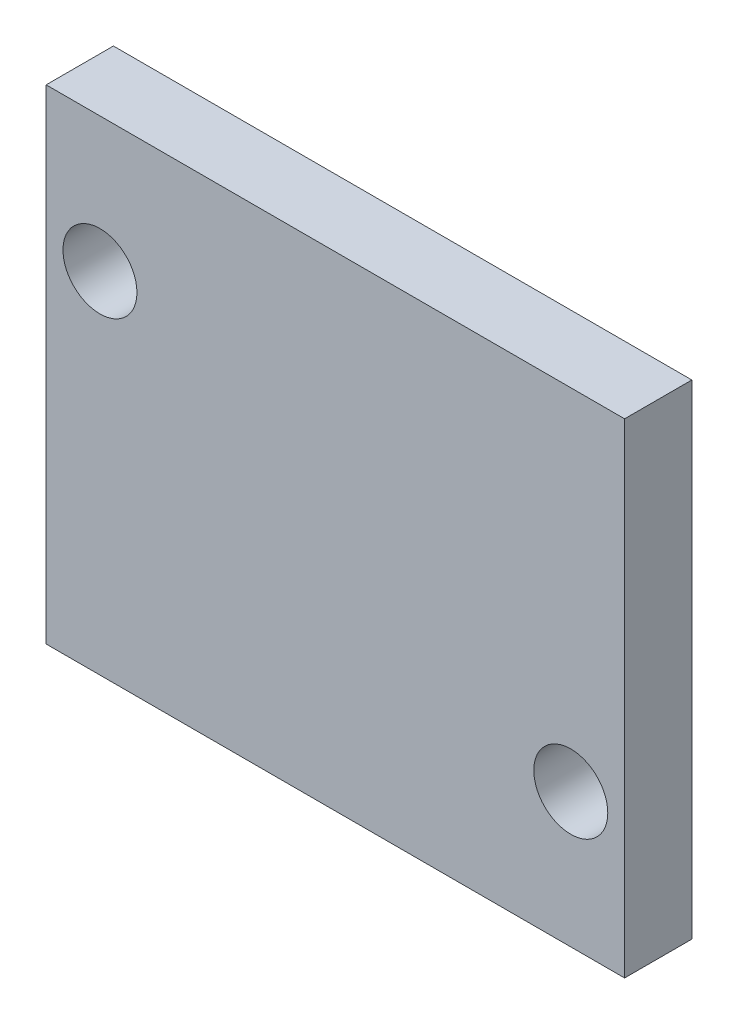
from build123d import *

# Parameters (mm, degrees)
SKIZZE1_W                       = 43
SKIZZE1_H                       = 36
SKIZZE1_R                       = 2.75
AUFSATZ_LINEAR_AUSTRAGEN1_DEPTH = 5


with BuildPart() as part:
    # Skizze1 → Aufsatz-Linear austragen1 (new body)
    with BuildSketch(Plane.XY):
        with Locations((21.5, 18)):
            Rectangle(SKIZZE1_W, SKIZZE1_H)
        with Locations((4, 26)):
            Circle(SKIZZE1_R, mode=Mode.SUBTRACT)
        with Locations((39, 10)):
            Circle(SKIZZE1_R, mode=Mode.SUBTRACT)
    extrude(amount=AUFSATZ_LINEAR_AUSTRAGEN1_DEPTH)


solid = part.part
